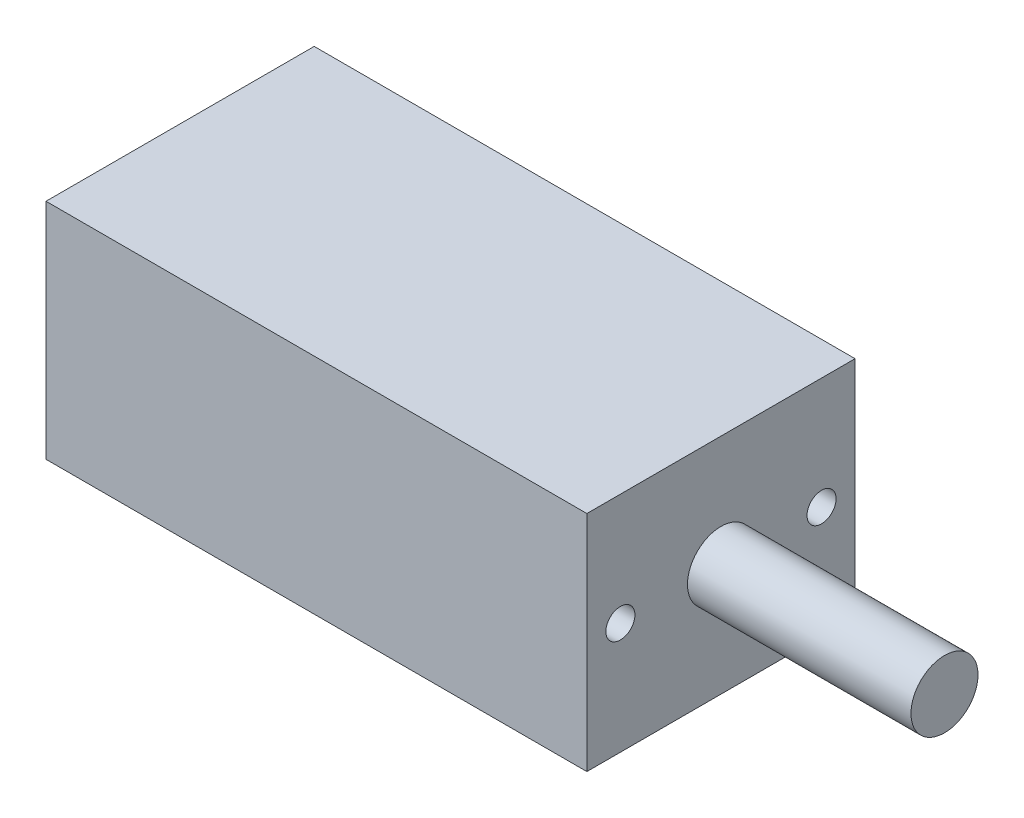
from build123d import *

# Parameters (mm, degrees)
SKETCH1_W           = 12
SKETCH1_H           = 10
BOSS_EXTRUDE1_DEPTH = 24.2
SKETCH2_R           = 1.5
BOSS_EXTRUDE2_DEPTH = 10
SKETCH3_R           = 0.65
CUT_EXTRUDE1_DEPTH  = 1


with BuildPart() as part:
    # Sketch1 → Boss-Extrude1 (new body)
    with BuildSketch(Plane(origin=(0, 0, 0), x_dir=(0, 0, -1), z_dir=(1, 0, 0))):
        Rectangle(SKETCH1_W, SKETCH1_H)
    extrude(amount=BOSS_EXTRUDE1_DEPTH)

    # Sketch2 → Boss-Extrude2 (add)
    with BuildSketch(Plane(origin=(24.2, 0, 0), x_dir=(0, 0, -1), z_dir=(1, 0, 0))):
        Circle(SKETCH2_R)
    extrude(amount=BOSS_EXTRUDE2_DEPTH)

    # Sketch3 → Cut-Extrude1 (cut)
    with BuildSketch(Plane(origin=(24.2, 0, 0), x_dir=(0, 0, -1), z_dir=(1, 0, 0))):
        with Locations((-4.5, 0)):
            Circle(SKETCH3_R)
        with Locations((4.5, 0)):
            Circle(SKETCH3_R)
    extrude(amount=-CUT_EXTRUDE1_DEPTH, mode=Mode.SUBTRACT)


solid = part.part
